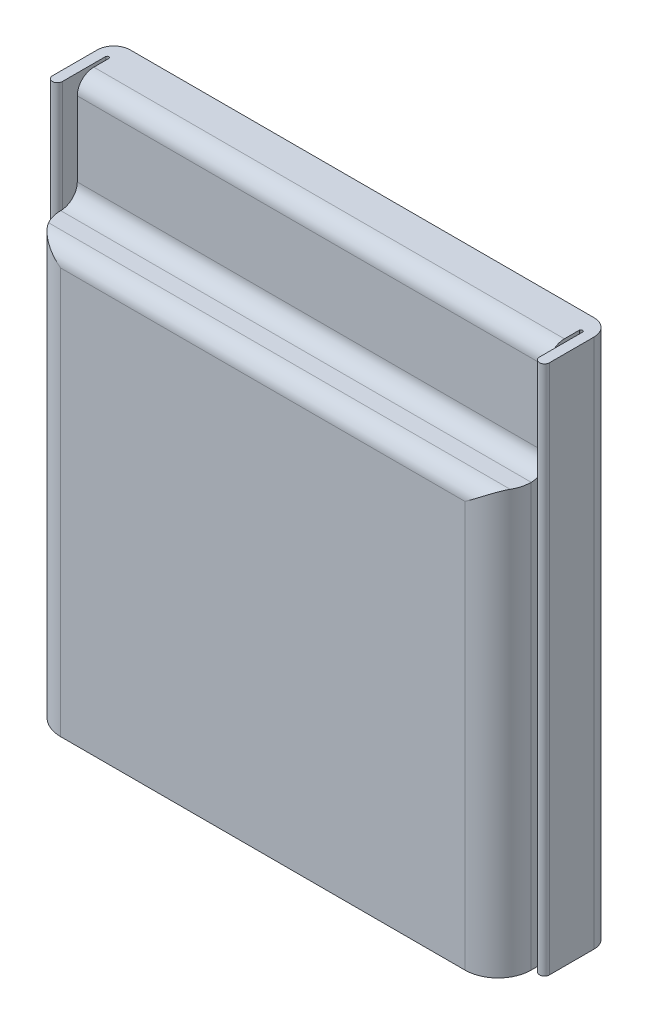
from build123d import *

# Parameters (mm, degrees)
EXTRUDE_1_DEPTH                 = 16
CUT_EXTRUDE_1_REACH             = 24.738
CUT_EXTRUDE_1_DIRECTION_2_REACH = 24.738


with BuildPart() as part:
    # Эскиз1 → Бобышка-Вытянуть1 (new, symmetric)
    with BuildSketch(Plane(origin=(0, 0, 0), x_dir=(1, 0, 0), z_dir=(0, 1, 0))):
        with BuildLine():
            Line((-14, 0), (14, 0))
            ThreePointArc((14, 0), (14.707106781, -0.292893219), (15, -1))
            Line((15, -1), (15, -3.7))
            ThreePointArc((15, -3.7), (14.7, -4), (14.4, -3.7))
            Line((14.4, -3.7), (14.4, -1.1))
            ThreePointArc((14.4, -1.1), (14.3, -1), (14.2, -1.1))
            Line((14.2, -1.1), (14.2, -4))
            ThreePointArc((14.2, -4), (13.614213562, -5.414213562), (12.2, -6))
            Line((12.2, -6), (-12.2, -6))
            ThreePointArc((-12.2, -6), (-13.614213562, -5.414213562), (-14.2, -4))
            Line((-14.2, -4), (-14.2, -1.1))
            ThreePointArc((-14.2, -1.1), (-14.3, -1), (-14.4, -1.1))
            Line((-14.4, -1.1), (-14.4, -3.7))
            ThreePointArc((-14.4, -3.7), (-14.7, -4), (-15, -3.7))
            Line((-15, -3.7), (-15, -1))
            ThreePointArc((-15, -1), (-14.707106781, -0.292893219), (-14, 0))
        make_face()
    extrude(amount=EXTRUDE_1_DEPTH, both=True)

    # Эскиз2 → Вырез-Вытянуть1 (cut, up to next)
    with BuildSketch(Plane(origin=(0, 0, 0), x_dir=(0, 0, -1), z_dir=(1, 0, 0)), mode=Mode.PRIVATE) as cut_extrude_1_sk1:
        with BuildLine():
            Line((-3, 15), (-3, 10.5))
            ThreePointArc((-3, 10.5), (-3.292893219, 9.792893219), (-4, 9.5))
            Line((-4, 9.5), (-5, 9.5))
            ThreePointArc((-5, 9.5), (-5.707106781, 9.207106781), (-6, 8.5))
            Line((-6, 8.5), (-6, 16))
            Line((-6, 16), (-2, 16))
            ThreePointArc((-2, 16), (-2.707106781, 15.707106781), (-3, 15))
        make_face()
    cut_extrude_1_tool1 = extrude(cut_extrude_1_sk1.sketch, amount=-CUT_EXTRUDE_1_REACH, mode=Mode.PRIVATE) & part.part
    add(cut_extrude_1_tool1.solids().sort_by_distance((0, 12.778083, 4.509034))[0], mode=Mode.SUBTRACT)

    # Эскиз2 → Вырез-Вытянуть1 direction 2 (cut, up to next)
    with BuildSketch(Plane(origin=(0, 0, 0), x_dir=(0, 0, -1), z_dir=(1, 0, 0)), mode=Mode.PRIVATE) as cut_extrude_1_direction_2_sk1:
        with BuildLine():
            Line((-3, 15), (-3, 10.5))
            ThreePointArc((-3, 10.5), (-3.292893219, 9.792893219), (-4, 9.5))
            Line((-4, 9.5), (-5, 9.5))
            ThreePointArc((-5, 9.5), (-5.707106781, 9.207106781), (-6, 8.5))
            Line((-6, 8.5), (-6, 16))
            Line((-6, 16), (-2, 16))
            ThreePointArc((-2, 16), (-2.707106781, 15.707106781), (-3, 15))
        make_face()
    cut_extrude_1_direction_2_tool1 = extrude(cut_extrude_1_direction_2_sk1.sketch, amount=CUT_EXTRUDE_1_DIRECTION_2_REACH, mode=Mode.PRIVATE) & part.part
    add(cut_extrude_1_direction_2_tool1.solids().sort_by_distance((0, 12.778083, 4.509034))[0], mode=Mode.SUBTRACT)


solid = part.part
